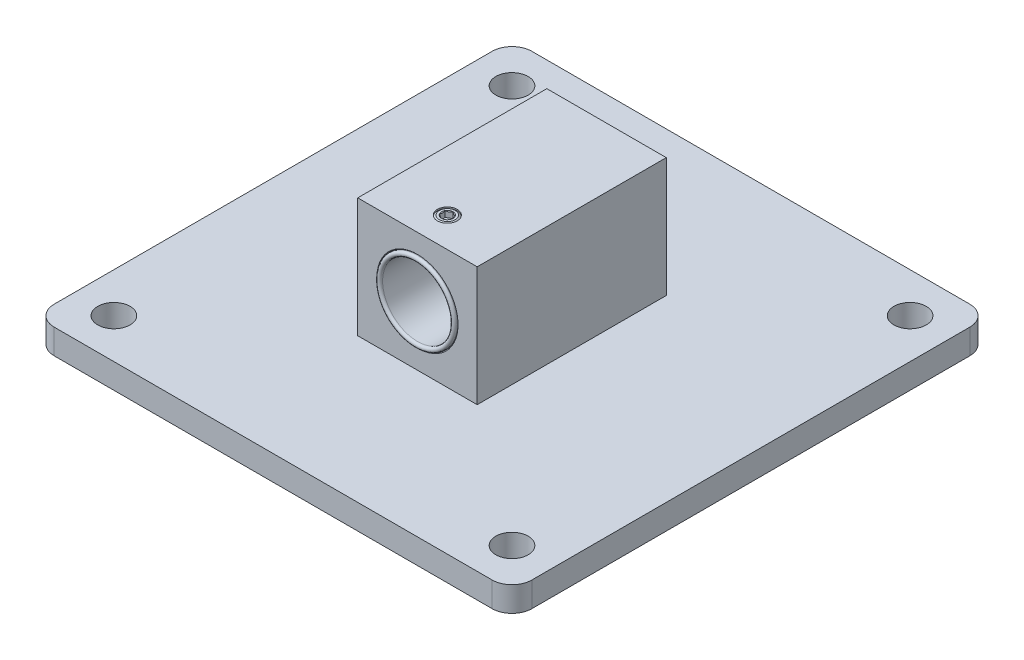
from build123d import *

# Parameters (mm, degrees)
SKETCH1_R               = 5.1562
BOSS_EXTRUDE1_DEPTH     = 3.96875
SKETCH2_W               = 38.1
SKETCH2_H               = 38.1
SKETCH2_R               = 12.7
BOSS_EXTRUDE2_DEPTH     = 30.1625
CHAMFER1_SIZE           = 0.254
CUT_EXTRUDE1_REACH      = 119.185
CUT_EXTRUDE1_END_RADIUS = 12.7
SKETCH4_R               = 3.175
CUT_EXTRUDE2_DEPTH      = 1.905


with BuildPart() as part:
    # Sketch1 → Boss-Extrude1 (new, symmetric)
    with BuildSketch(Plane(origin=(0, 0, 0), x_dir=(1, 0, 0), z_dir=(0, 1, 0))):
        with BuildLine():
            Line((-69.85, 76.2), (69.85, 76.2))
            ThreePointArc((69.85, 76.2), (74.340128061, 74.340128061), (76.2, 69.85))
            Line((76.2, 69.85), (76.2, -69.85))
            ThreePointArc((76.2, -69.85), (74.340128061, -74.340128061), (69.85, -76.2))
            Line((69.85, -76.2), (-69.85, -76.2))
            ThreePointArc((-69.85, -76.2), (-74.340128061, -74.340128061), (-76.2, -69.85))
            Line((-76.2, -69.85), (-76.2, 69.85))
            ThreePointArc((-76.2, 69.85), (-74.340128061, 74.340128061), (-69.85, 76.2))
        make_face()
        with Locations(Location((-63.5, 63.5, 0), (0, 0, 270))):
            Circle(SKETCH1_R, mode=Mode.SUBTRACT)
        with Locations(Location((63.5, 63.5, 0), (0, 0, 90))):
            Circle(SKETCH1_R, mode=Mode.SUBTRACT)
        with Locations(Location((63.5, -63.5, 0), (0, 0, 270))):
            Circle(SKETCH1_R, mode=Mode.SUBTRACT)
        with Locations(Location((-63.5, -63.5, 0), (0, 0, 90))):
            Circle(SKETCH1_R, mode=Mode.SUBTRACT)
    extrude(amount=BOSS_EXTRUDE1_DEPTH, both=True)

    # Sketch2 → Boss-Extrude2 (add, symmetric)
    with BuildSketch(Plane.XY):
        with Locations((0, 23.01875)):
            Rectangle(SKETCH2_W, SKETCH2_H)
        with Locations(Location((0, 23.01875, 0), (0, 0, 180))):
            Circle(SKETCH2_R, mode=Mode.SUBTRACT)
    extrude(amount=BOSS_EXTRUDE2_DEPTH, both=True)

    # Chamfer1
    chamfer1_edges = [part.edges().sort_by_distance(p)[0] for p in [
        (12.7, 23.01875, -30.1625),
        (12.7, 23.01875, 30.1625),
    ]]
    chamfer(chamfer1_edges, length=CHAMFER1_SIZE)

    # Cut-Extrude1: up to this cylinder (the profile starts outside it)
    cut_extrude1_end = Plane(origin=(0, 23.01875, 20.6375), z_dir=(0, 0, -1)) * Cylinder(CUT_EXTRUDE1_END_RADIUS, 264.77, mode=Mode.PRIVATE)
    # Sketch4 → Cut-Extrude1 (cut, up to the surface)
    with BuildSketch(Plane(origin=(0, 42.06875, 0), x_dir=(1, 0, 0), z_dir=(0, 1, 0)), mode=Mode.PRIVATE) as cut_extrude1_sk1:
        with Locations(Location((0, -20.6375, 0), (0, 0, 270))):
            Circle(SKETCH4_R)
    cut_extrude1_tool1 = extrude(cut_extrude1_sk1.sketch, amount=-CUT_EXTRUDE1_REACH, mode=Mode.PRIVATE) - cut_extrude1_end
    add(cut_extrude1_tool1.solids().sort_by_distance((0, 42.06875, 20.6375))[0], mode=Mode.SUBTRACT)


with BuildPart() as body_2:
    # Sketch3 → Revolve1 (revolve)
    with BuildSketch(Plane(origin=(0, 0, 0), x_dir=(0, 0, -1), z_dir=(1, 0, 0)), mode=Mode.PRIVATE) as revolve1_sk:
        with BuildLine():
            Line((-30.1625, 35.71875), (0, 35.71875))
            Line((0, 35.71875), (0, 34.13125))
            Line((0, 34.13125), (-30.1625, 34.13125))
            ThreePointArc((-30.1625, 34.13125), (-30.95625, 34.925), (-30.1625, 35.71875))
        make_face()
        with BuildLine():
            Line((11.90625, 35.71875), (29.36875, 35.71875))
            ThreePointArc((29.36875, 35.71875), (30.1625, 34.925), (29.36875, 34.13125))
            Line((29.36875, 34.13125), (11.90625, 34.13125))
            Line((11.90625, 34.13125), (11.90625, 35.71875))
        make_face()
    revolve(revolve1_sk.sketch.rotate(Axis((0, 23.01875, 30.1625), (0, 0, -1)), 90), axis=Axis((0, 23.01875, 30.1625), (0, 0, -1)))


with BuildPart() as body_3:
    # Sketch5 → Revolve2 (revolve)
    with BuildSketch(Plane(origin=(0, 0, 0), x_dir=(0, 0, -1), z_dir=(1, 0, 0))):
        Polygon((-23.1775, 42.06875), (-22.47011, 42.06875), (-22.225, 41.82364), (-22.225, 40.16375), (-20.6375, 40.16375), (-20.6375, 35.71875), (-22.3774, 35.71875), (-23.8125, 37.15385), (-23.8125, 41.624118213), align=None)
    revolve(axis=Axis((0, 42.06875, 20.6375), (0, -1, 0)))

    # Sketch6 → Cut-Extrude2 (cut)
    with BuildSketch(Plane(origin=(0, 42.06875, 0), x_dir=(1, 0, 0), z_dir=(0, 1, 0))):
        Polygon((0, -18.804412895), (-1.5875, -19.720956448), (-1.5875, -21.554043552), (0, -22.470587105), (1.5875, -21.554043552), (1.5875, -19.720956448), align=None)
    extrude(amount=-CUT_EXTRUDE2_DEPTH, mode=Mode.SUBTRACT)


solid = Compound([part.part, body_2.part, body_3.part])
